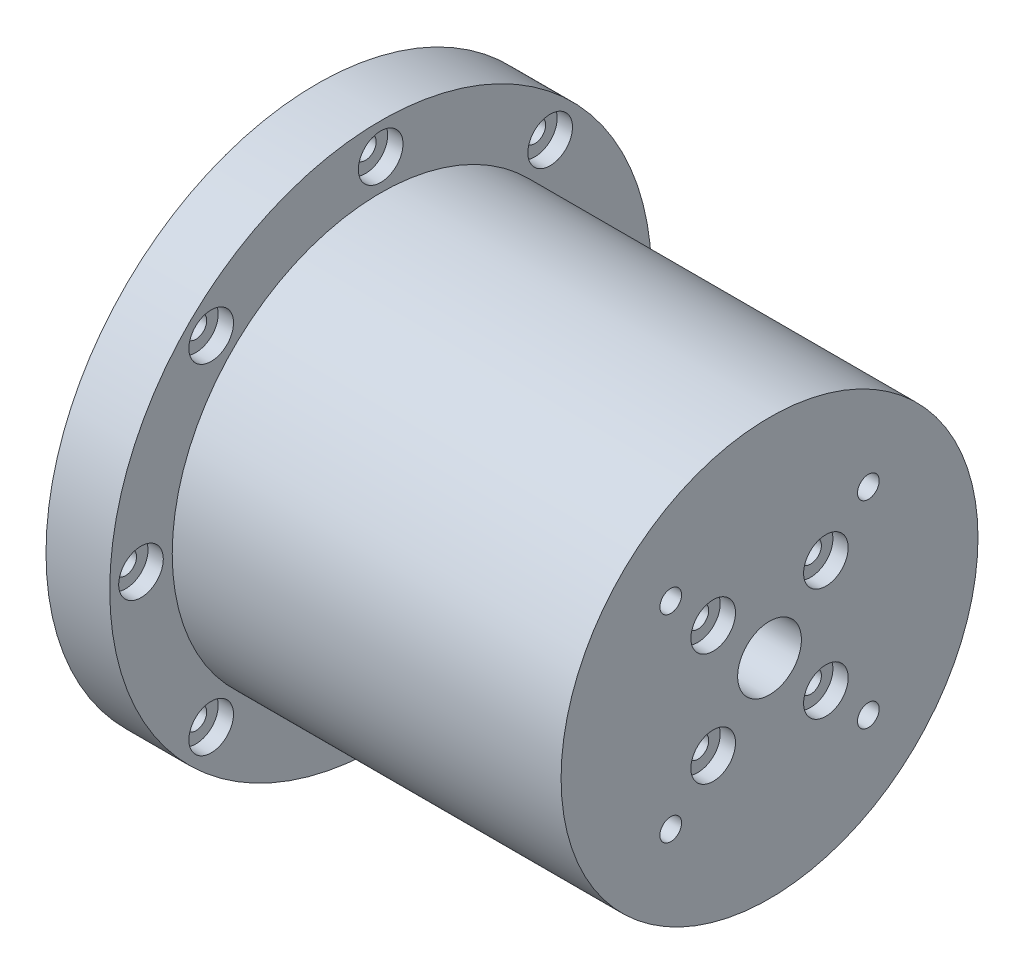
from build123d import *

# Parameters (mm, degrees)
CROQUIS1_R                                           = 32.7
CROQUIS1_R_2                                         = 5
SALIENTE_EXTRUIR1_DEPTH                              = 4.25
REFRENTADO_PARA_TORNILLO_CON_CABEZA_TRON_D           = 3.4
REFRENTADO_PARA_TORNILLO_CON_CABEZA_TRON_CBORE_D     = 7
REFRENTADO_PARA_TORNILLO_CON_CABEZA_TRON_CBORE_DEPTH = 2.4
CROQUIS5_R                                           = 32.7
CROQUIS5_R_2                                         = 21.5
SALIENTE_EXTRUIR2_DEPTH                              = 55
TALADRO_DE_MARGEN_PARA_M31_D                         = 3.4
TALADRO_DE_MARGEN_PARA_M31_DEPTH                     = 15
TALADRO_DE_MARGEN_PARA_M31_TIP                       = 1.021463052
TALADRO_DE_MARGEN_PARA_M32_D                         = 3.4
TALADRO_DE_MARGEN_PARA_M32_DEPTH                     = 16.5
TALADRO_DE_MARGEN_PARA_M32_TIP                       = 1.021463052
CROQUIS16_R                                          = 32.7
SALIENTE_EXTRUIR3_DEPTH                              = 7.5
SALIENTE_EXTRUIR4_START                              = -10
CROQUIS17_R                                          = 42.5
CROQUIS17_R_2                                        = 32.7
SALIENTE_EXTRUIR4_DEPTH                              = 10
REFRENTADO_PARA_TORNILLO_CON_CABEZA_2_D              = 3.4
REFRENTADO_PARA_TORNILLO_CON_CABEZA_2_CBORE_D        = 7
REFRENTADO_PARA_TORNILLO_CON_CABEZA_2_CBORE_DEPTH    = 2.4


with BuildPart() as part:
    # Croquis1 → Saliente-Extruir1 (new, symmetric)
    with BuildSketch(Plane(origin=(0, 0, 0), x_dir=(0, 0, -1), z_dir=(1, 0, 0))):
        Circle(CROQUIS1_R)
        Circle(CROQUIS1_R_2, mode=Mode.SUBTRACT)
    extrude(amount=SALIENTE_EXTRUIR1_DEPTH, both=True)

    # Refrentado para tornillo con cabeza tron (through all)
    with Locations(Plane(origin=(4.25, 0, 0), x_dir=(0, 0, -1), z_dir=(1, 0, 0))):
        with Locations((8.838834765, 8.838834765), (-8.838834765, -8.838834765), (-8.838834765, 8.838834765), (8.838834765, -8.838834765)):
            CounterBoreHole(REFRENTADO_PARA_TORNILLO_CON_CABEZA_TRON_D / 2, REFRENTADO_PARA_TORNILLO_CON_CABEZA_TRON_CBORE_D / 2, REFRENTADO_PARA_TORNILLO_CON_CABEZA_TRON_CBORE_DEPTH)

    # Croquis5 → Saliente-Extruir2 (add)
    with BuildSketch(Plane.ZY.offset(4.25)):
        Circle(CROQUIS5_R)
        Circle(CROQUIS5_R_2, mode=Mode.SUBTRACT)
    extrude(amount=SALIENTE_EXTRUIR2_DEPTH)

    # Taladro de margen para M31
    with Locations(Plane.ZY.offset(59.25)):
        with Locations((17.075, 17.075), (-17.075, -17.075), (-17.075, 17.075), (17.075, -17.075)):
            Hole(TALADRO_DE_MARGEN_PARA_M31_D / 2, depth=TALADRO_DE_MARGEN_PARA_M31_DEPTH)
            with Locations((0, 0, -(TALADRO_DE_MARGEN_PARA_M31_DEPTH + TALADRO_DE_MARGEN_PARA_M31_TIP / 2))):  # 118° drill point
                Cone(0, TALADRO_DE_MARGEN_PARA_M31_D / 2, TALADRO_DE_MARGEN_PARA_M31_TIP, mode=Mode.SUBTRACT)

    # Taladro de margen para M32
    with Locations(Plane(origin=(4.25, 0, 0), x_dir=(0, 0, -1), z_dir=(1, 0, 0))):
        with Locations((15.5, 15.5), (-15.5, -15.5), (-15.5, 15.5), (15.5, -15.5)):
            Hole(TALADRO_DE_MARGEN_PARA_M32_D / 2, depth=TALADRO_DE_MARGEN_PARA_M32_DEPTH)
            with Locations((0, 0, -(TALADRO_DE_MARGEN_PARA_M32_DEPTH + TALADRO_DE_MARGEN_PARA_M32_TIP / 2))):  # 118° drill point
                Cone(0, TALADRO_DE_MARGEN_PARA_M32_D / 2, TALADRO_DE_MARGEN_PARA_M32_TIP, mode=Mode.SUBTRACT)

    # Croquis16 → Saliente-Extruir3 (add)
    with BuildSketch(Plane.ZY.offset(59.25)):
        Circle(CROQUIS16_R)
        with BuildLine():
            Line((-16.5, 21.5), (16.5, 21.5))
            ThreePointArc((16.5, 21.5), (20.035533906, 20.035533906), (21.5, 16.5))
            Line((21.5, 16.5), (21.5, -16.5))
            ThreePointArc((21.5, -16.5), (20.035533906, -20.035533906), (16.5, -21.5))
            Line((16.5, -21.5), (-16.5, -21.5))
            ThreePointArc((-16.5, -21.5), (-20.035533906, -20.035533906), (-21.5, -16.5))
            Line((-21.5, -16.5), (-21.5, 16.5))
            ThreePointArc((-21.5, 16.5), (-20.035533906, 20.035533906), (-16.5, 21.5))
        make_face(mode=Mode.SUBTRACT)
    extrude(amount=SALIENTE_EXTRUIR3_DEPTH)

    # Croquis17 → Saliente-Extruir4 (add)
    with BuildSketch(Plane.ZY.offset(66.75).offset(SALIENTE_EXTRUIR4_START)):
        Circle(CROQUIS17_R)
        Circle(CROQUIS17_R_2, mode=Mode.SUBTRACT)
    extrude(amount=SALIENTE_EXTRUIR4_DEPTH)

    # Refrentado para tornillo con cabeza  2 (through all)
    with Locations(Plane(origin=(-56.75, 0, 0), x_dir=(0, 0, -1), z_dir=(1, 0, 0))):
        with Locations((0, 37.6), (26.587214973, 26.587214973), (37.6, 0), (26.587214973, -26.587214973), (0, -37.6), (-26.587214973, -26.587214973), (-37.6, 0), (-26.587214973, 26.587214973)):
            CounterBoreHole(REFRENTADO_PARA_TORNILLO_CON_CABEZA_2_D / 2, REFRENTADO_PARA_TORNILLO_CON_CABEZA_2_CBORE_D / 2, REFRENTADO_PARA_TORNILLO_CON_CABEZA_2_CBORE_DEPTH)


solid = part.part
